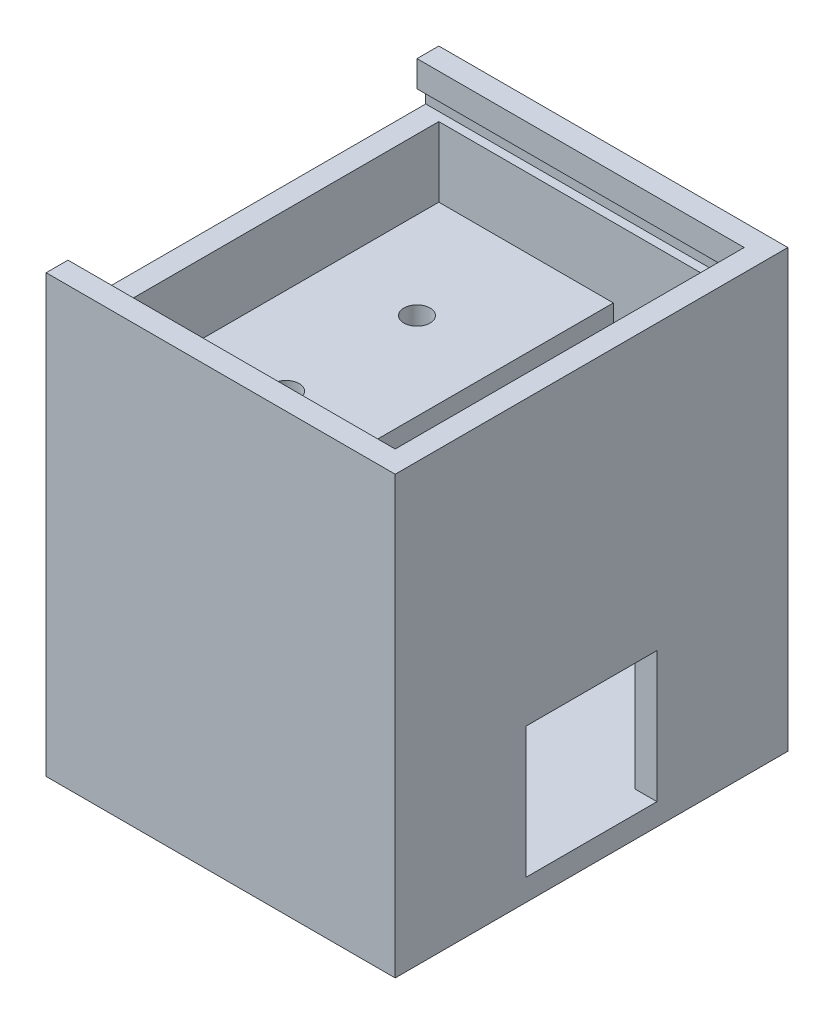
from build123d import *

# Parameters (mm, degrees)
SKETCH1_W           = 40
SKETCH1_H           = 45
BOSS_EXTRUDE1_DEPTH = 50
SHELL1_T            = -2.5
SKETCH3_W           = 40
SKETCH3_H           = 34.5
BOSS_EXTRUDE2_DEPTH = 20
SKETCH11_W          = 40
SKETCH11_H          = 5
CUT_EXTRUDE2_DEPTH  = 2.5
SKETCH12_W          = 37.5
SKETCH12_H          = 2
CUT_EXTRUDE3_DEPTH  = 1
SKETCH13_W          = 37.5
SKETCH13_H          = 2
CUT_EXTRUDE4_DEPTH  = 1
SKETCH15_R          = 1.5
CUT_EXTRUDE7_DEPTH  = 37
SKETCH16_R          = 1.5
CUT_EXTRUDE8_DEPTH  = 37
SKETCH17_R          = 3
CUT_EXTRUDE9_DEPTH  = 5
SKETCH19_W          = 15
SKETCH19_H          = 15
CUT_EXTRUDE10_DEPTH = 2.5


with BuildPart() as part:
    # Sketch1 → Boss-Extrude1 (new body)
    with BuildSketch(Plane(origin=(0, 0, 0), x_dir=(1, 0, 0), z_dir=(0, 1, 0))):
        with Locations((-14.888700463, -8.449653636)):
            Rectangle(SKETCH1_W, SKETCH1_H)
    extrude(amount=BOSS_EXTRUDE1_DEPTH)

    # Shell1
    shell1_openings = [part.faces().sort_by_distance(p)[0] for p in [
        (-14.888700463, 50, 8.449653636),
    ]]
    offset(amount=SHELL1_T, openings=shell1_openings, kind=Kind.INTERSECTION)

    # Sketch3 → Boss-Extrude2 (add)
    with BuildSketch(Plane(origin=(-32.388700463, 0, 0), x_dir=(0, 0, -1), z_dir=(1, 0, 0))):
        with Locations((-8.449653636, 19.75)):
            Rectangle(SKETCH3_W, SKETCH3_H)
    extrude(amount=BOSS_EXTRUDE2_DEPTH)

    # Sketch11 → Cut-Extrude2 (cut)
    with BuildSketch(Plane(origin=(-32.388700463, 0, 0), x_dir=(0, 0, -1), z_dir=(1, 0, 0))):
        with Locations((-8.449653636, 47.5)):
            Rectangle(SKETCH11_W, SKETCH11_H)
    extrude(amount=-CUT_EXTRUDE2_DEPTH, mode=Mode.SUBTRACT)

    # Sketch12 → Cut-Extrude3 (cut)
    with BuildSketch(Plane.XY.offset(-11.550346364)):
        with Locations((-16.138700463, 46)):
            Rectangle(SKETCH12_W, SKETCH12_H)
    extrude(amount=-CUT_EXTRUDE3_DEPTH, mode=Mode.SUBTRACT)

    # Sketch13 → Cut-Extrude4 (cut)
    with BuildSketch(Plane(origin=(0, 0, 28.449653636), x_dir=(-1, 0, 0), z_dir=(0, 0, -1))):
        with Locations((16.138700463, 46)):
            Rectangle(SKETCH13_W, SKETCH13_H)
    extrude(amount=-CUT_EXTRUDE4_DEPTH, mode=Mode.SUBTRACT)

    # Sketch15 → Cut-Extrude7 (cut)
    with BuildSketch(Plane(origin=(0, 37, 0), x_dir=(1, 0, 0), z_dir=(0, 1, 0))):
        with Locations(Location((-22.388700463, -15.949653636, 0), (0, 0, 270))):
            Circle(SKETCH15_R)
    extrude(amount=-CUT_EXTRUDE7_DEPTH, mode=Mode.SUBTRACT)

    # Sketch16 → Cut-Extrude8 (cut)
    with BuildSketch(Plane(origin=(0, 37, 0), x_dir=(1, 0, 0), z_dir=(0, 1, 0))):
        with Locations(Location((-22.388700463, -0.949653636, 0), (0, 0, 270))):
            Circle(SKETCH16_R)
    extrude(amount=-CUT_EXTRUDE8_DEPTH, mode=Mode.SUBTRACT)

    # Sketch17 → Cut-Extrude9 (cut)
    with BuildSketch(Plane.XZ):
        with Locations(Location((-22.388700463, 15.949653636, 0), (0, 0, 270))):
            Circle(SKETCH17_R)
        with Locations(Location((-22.388700463, 0.949653636, 0), (0, 0, 270))):
            Circle(SKETCH17_R)
    extrude(amount=-CUT_EXTRUDE9_DEPTH, mode=Mode.SUBTRACT)

    # Sketch19 → Cut-Extrude10 (cut)
    with BuildSketch(Plane.ZY.offset(-2.611299537)):
        with Locations((8.449653636, 10)):
            Rectangle(SKETCH19_W, SKETCH19_H)
    extrude(amount=-CUT_EXTRUDE10_DEPTH, mode=Mode.SUBTRACT)


solid = part.part
